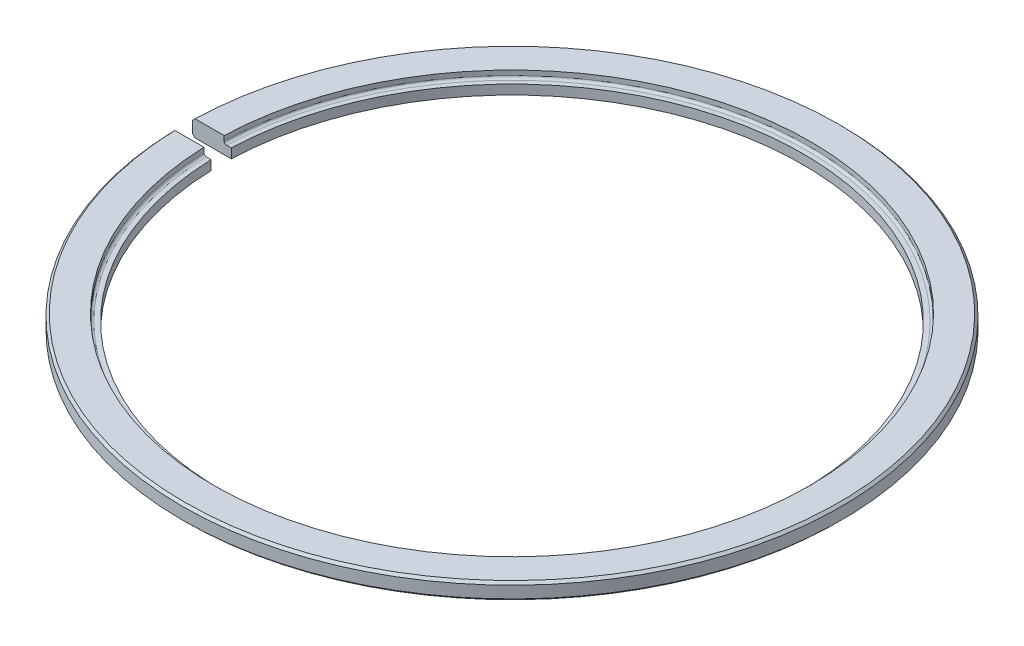
from build123d import *

# Parameters (mm, degrees)
FILLET1_R          = 0.254
CHAMFER1_SIZE      = 0.254
SKETCH2_W          = 4.146231659
SKETCH2_H          = 2.159
CUT_EXTRUDE1_DEPTH = 50.872125446


with BuildPart() as part:
    # Sketch1 → Revolve1 (revolve)
    with BuildSketch(Plane.XY, mode=Mode.PRIVATE) as revolve1_sk:
        Polygon((35.2425, 0), (35.2425, 1.778), (31.877, 1.778), (31.877, 1.016), (31.115, 1.016), (31.115, 0), align=None)
    revolve(revolve1_sk.sketch.rotate(Axis((0, 0, 0), (0, 1, 0)), 90), axis=Axis((0, 0, 0), (0, 1, 0)))

    # Fillet1
    fillet1_edges = [part.edges().sort_by_distance(p)[0] for p in [
        (0, 1.016, 31.877),
    ]]
    fillet(fillet1_edges, radius=FILLET1_R)

    # Chamfer1
    chamfer1_edges = [part.edges().sort_by_distance(p)[0] for p in [
        (0, 1.778, 35.2425),
        (0, 0, 35.2425),
    ]]
    chamfer(chamfer1_edges, length=CHAMFER1_SIZE)

    # Sketch2 → Cut-Extrude1 (cut, through all)
    with BuildSketch(Plane(origin=(0, 1.778, 0), x_dir=(1, 0, 0), z_dir=(0, 1, 0))):
        with Locations((-33.169384171, 0)):
            Rectangle(SKETCH2_W, SKETCH2_H)
    extrude(amount=-CUT_EXTRUDE1_DEPTH, mode=Mode.SUBTRACT)


solid = part.part
